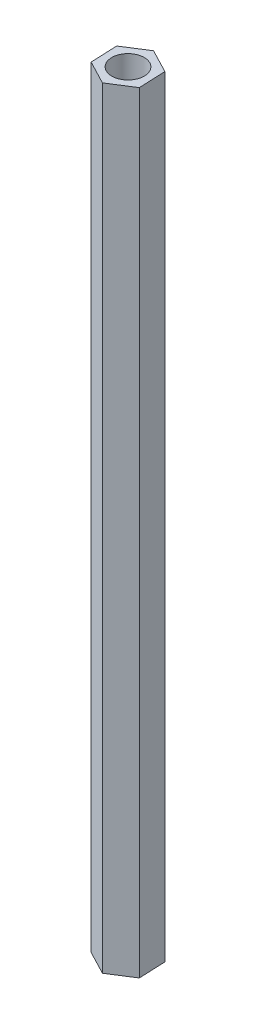
from build123d import *

# Parameters (mm, degrees)
SKETCH_1_R      = 2.1
EXTRUDE_1_DEPTH = 60
SKETCH_2_R      = 2.1
EXTRUDE_2_DEPTH = 40


with BuildPart() as part:
    # 草图1 → 凸台-拉伸1 (new body)
    with BuildSketch(Plane(origin=(0, 0, 0), x_dir=(1, 0, 0), z_dir=(0, 1, 0))):
        Polygon((3.070700034, -1.603371853), (2.923910774, 1.85761831), (-0.14678926, 3.460990164), (-3.070700034, 1.603371853), (-2.923910774, -1.85761831), (0.14678926, -3.460990164), align=None)
        with Locations(Location((0, 0, 0), (0, 0, 270))):
            Circle(SKETCH_1_R, mode=Mode.SUBTRACT)
    extrude(amount=EXTRUDE_1_DEPTH)

    # 草图2 → 凸台-拉伸2 (add)
    with BuildSketch(Plane(origin=(0, 60, 0), x_dir=(1, 0, 0), z_dir=(0, 1, 0))):
        Polygon((-2.923910774, -1.85761831), (0.14678926, -3.460990164), (3.070700034, -1.603371853), (2.923910774, 1.85761831), (-0.14678926, 3.460990164), (-3.070700034, 1.603371853), align=None)
        with Locations(Location((0, 0, 0), (0, 0, 270))):
            Circle(SKETCH_2_R, mode=Mode.SUBTRACT)
    extrude(amount=EXTRUDE_2_DEPTH)


solid = part.part
